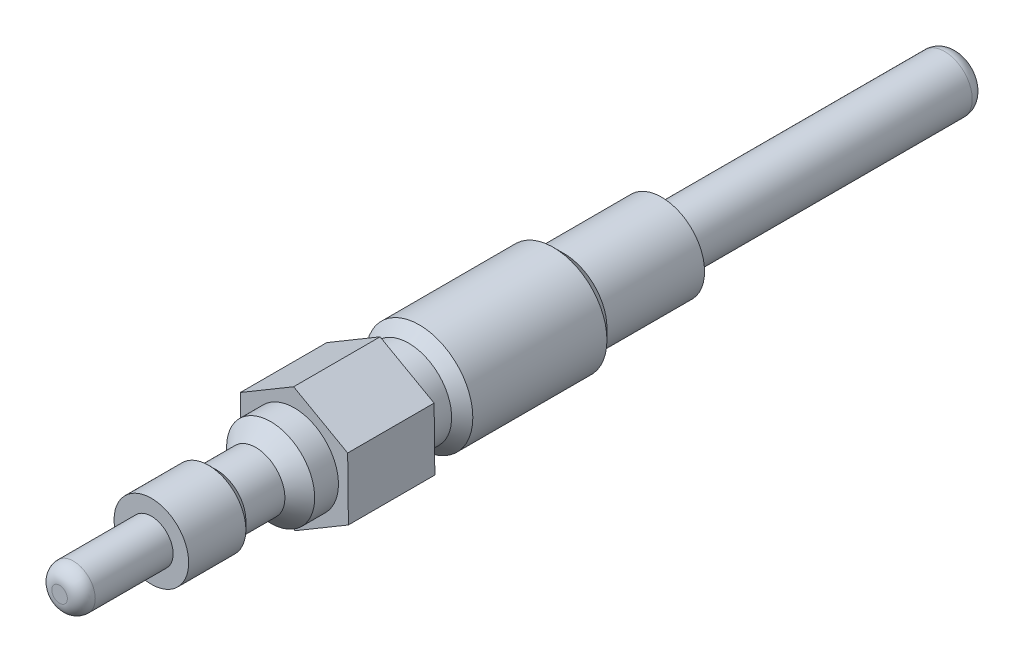
from build123d import *

# Parameters (mm, degrees)
BOSS_EXTRUDE1_DEPTH = 7.874
SKETCH2_R           = 4.0132
BOSS_EXTRUDE2_DEPTH = 21.3868
SKETCH3_R           = 4.8768
BOSS_EXTRUDE3_DEPTH = 52.6288
SKETCH10_W          = 30.48
SKETCH10_H          = 3.81
FILLET1_R           = 1.27
FILLET2_R           = 1.27


with BuildPart() as part:
    # Sketch1 → Boss-Extrude1 (new body)
    with BuildSketch(Plane.XY):
        Polygon((4.8552834, 2.881406504), (-0.067729531, 5.645502019), (-4.923012931, 2.764095515), (-4.8552834, -2.881406504), (0.067729531, -5.645502019), (4.923012931, -2.764095515), align=None)
    extrude(amount=BOSS_EXTRUDE1_DEPTH)

    # Sketch2 → Boss-Extrude2 (add)
    with BuildSketch(Plane.XY.offset(7.874)):
        with Locations(Location((0, 0, 0), (0, 0, 180))):
            Circle(SKETCH2_R)
    extrude(amount=BOSS_EXTRUDE2_DEPTH)

    # Sketch3 → Boss-Extrude3 (add)
    with BuildSketch(Plane(origin=(0, 0, 0), x_dir=(-1, 0, 0), z_dir=(0, 0, -1))):
        Circle(SKETCH3_R)
    extrude(amount=BOSS_EXTRUDE3_DEPTH)

    # Sketch8 → Cut-Revolve1 (revolve, cut)
    with BuildSketch(Plane(origin=(0, 0, 0), x_dir=(0, 0, -1), z_dir=(1, 0, 0)), mode=Mode.PRIVATE) as cut_revolve1_sk:
        Polygon((0, 3.9116), (2.54, 3.9116), (4.896343106, 6.267943106), (4.896343106, 7.7216), (0, 7.7216), align=None)
    revolve(cut_revolve1_sk.sketch.rotate(Axis((0, 0, -56.72328), (0, 0, 1)), 90), axis=Axis((0, 0, -56.72328), (0, 0, 1)), mode=Mode.SUBTRACT)

    # Sketch9 → Cut-Revolve2 (revolve, cut)
    with BuildSketch(Plane(origin=(0, 0, 0), x_dir=(0, 0, -1), z_dir=(1, 0, 0)), mode=Mode.PRIVATE) as cut_revolve2_sk:
        Polygon((16.6878, 3.9116), (14.870743755, 5.728656245), (14.870743755, 7.7216), (25.5778, 7.7216), (25.5778, 3.9116), align=None)
    revolve(cut_revolve2_sk.sketch.rotate(Axis((0, 0, -56.72328), (0, 0, 1)), 270), axis=Axis((0, 0, -56.72328), (0, 0, 1)), mode=Mode.SUBTRACT)

    # Sketch10 → Cut-Revolve3 (revolve, cut)
    with BuildSketch(Plane(origin=(0, 0, 0), x_dir=(0, 0, -1), z_dir=(1, 0, 0)), mode=Mode.PRIVATE) as cut_revolve3_sk:
        with Locations((40.8178, 4.4196)):
            Rectangle(SKETCH10_W, SKETCH10_H)
    revolve(cut_revolve3_sk.sketch.rotate(Axis((0, 0, -56.72328), (0, 0, 1)), 270), axis=Axis((0, 0, -56.72328), (0, 0, 1)), mode=Mode.SUBTRACT)

    # Fillet1
    fillet1_edges = [part.edges().sort_by_distance(p)[0] for p in [
        (-2.5146, 0, -52.6288),
    ]]
    fillet(fillet1_edges, radius=FILLET1_R)

    # Sketch13 → Cut-Revolve4 (revolve, cut)
    with BuildSketch(Plane(origin=(0, 0, 0), x_dir=(0, 0, -1), z_dir=(1, 0, 0)), mode=Mode.PRIVATE) as cut_revolve4_sk:
        Polygon((-10.033, 4.0132), (-11.3919, 2.6543), (-14.9479, 2.6543), (-15.691743647, 3.398143647), (-20.898743647, 3.398143647), (-20.898743647, 1.9812), (-29.2608, 1.9812), (-29.2608, 6.514945502), (-10.033, 6.514945502), align=None)
    revolve(cut_revolve4_sk.sketch.rotate(Axis((0, 0, -56.72328), (0, 0, 1)), 90), axis=Axis((0, 0, -56.72328), (0, 0, 1)), mode=Mode.SUBTRACT)

    # Fillet2
    fillet2_edges = [part.edges().sort_by_distance(p)[0] for p in [
        (1.9812, 0, 29.2608),
    ]]
    fillet(fillet2_edges, radius=FILLET2_R)


solid = part.part
